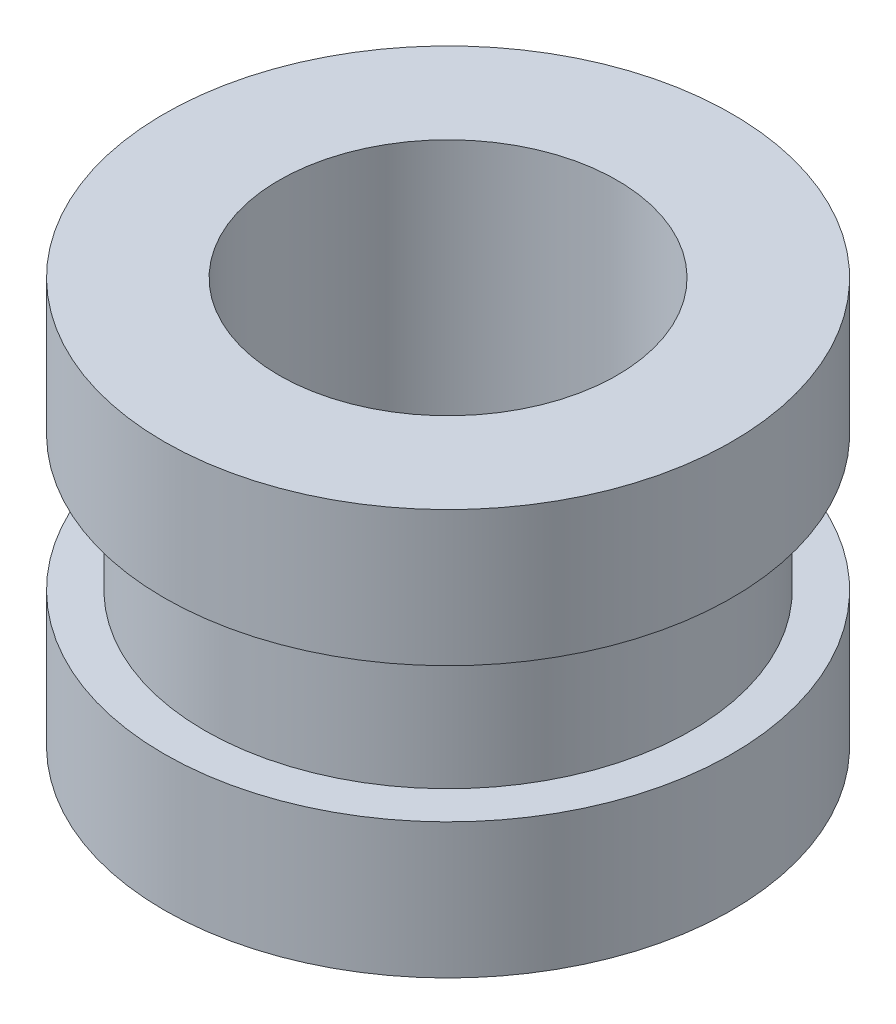
from build123d import *

# Parameters (mm, degrees)
SKETCH_1_R         = 2.1
EXTRUDE_1_DEPTH    = 1
SKETCH_2_R         = 1.8
EXTRUDE_2_DEPTH    = 1
SKETCH_3_R         = 2.1
EXTRUDE_3_DEPTH    = 1
HOLE_WIZARD_M3_1_D = 2.5


with BuildPart() as part:
    # 草图1 → 凸台-拉伸1 (new body)
    with BuildSketch(Plane(origin=(0, 0, 0), x_dir=(1, 0, 0), z_dir=(0, 1, 0))):
        with Locations(Location((0, 0, 0), (0, 0, 270))):
            Circle(SKETCH_1_R)
    extrude(amount=EXTRUDE_1_DEPTH)

    # 草图2 → 凸台-拉伸2 (add)
    with BuildSketch(Plane(origin=(0, 1, 0), x_dir=(1, 0, 0), z_dir=(0, 1, 0))):
        with Locations(Location((0, 0, 0), (0, 0, 270))):
            Circle(SKETCH_2_R)
    extrude(amount=EXTRUDE_2_DEPTH)

    # 草图3 → 凸台-拉伸3 (add)
    with BuildSketch(Plane(origin=(0, 2, 0), x_dir=(1, 0, 0), z_dir=(0, 1, 0))):
        with Locations(Location((0, 0, 0), (0, 0, 270))):
            Circle(SKETCH_3_R)
    extrude(amount=EXTRUDE_3_DEPTH)

    # M3 螺纹孔1 (through all)
    with Locations(Plane(origin=(0, 3, 0), x_dir=(1, 0, 0), z_dir=(0, 1, 0))):
        with Locations((0, 0)):
            Hole(HOLE_WIZARD_M3_1_D / 2)


solid = part.part
